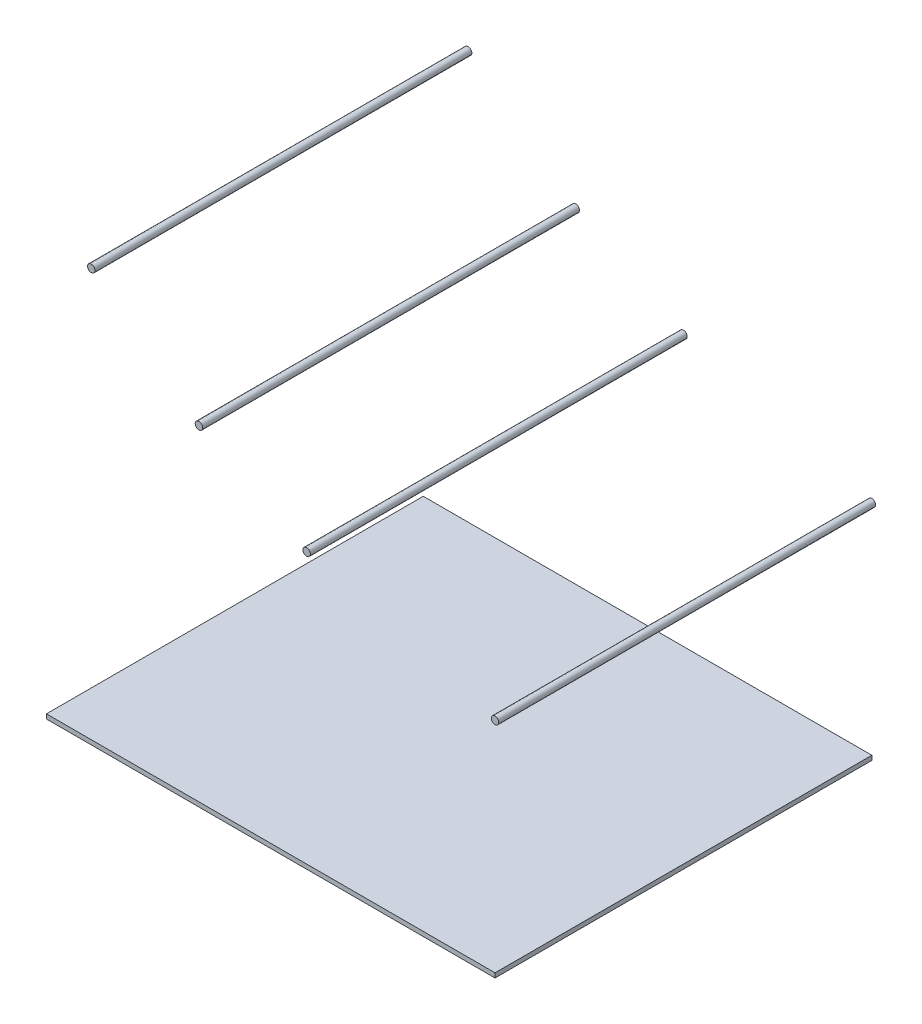
from build123d import *

# Parameters (mm, degrees)
SKETCH1_R             = 21.082
BOSS_EXTRUDE1_DEPTH   = 1066.8
BOSS_EXTRUDE1_2_DEPTH = 1066.8
BOSS_EXTRUDE1_3_DEPTH = 1066.8
BOSS_EXTRUDE1_4_DEPTH = 1066.8
SKETCH1_W             = 2540
SKETCH1_H             = 25.4
BOSS_EXTRUDE1_5_DEPTH = 1066.8


with BuildPart() as part:
    # Sketch1 → Boss-Extrude1 (new, symmetric)
    with BuildSketch(Plane.XY):
        with Locations((0, 1238.25)):
            Circle(SKETCH1_R)
    extrude(amount=BOSS_EXTRUDE1_DEPTH, both=True)


with BuildPart() as body_2:
    # Sketch1 → Boss-Extrude1 2 (new, symmetric)
    with BuildSketch(Plane.XY):
        with Locations((-1066.8, 1530.35)):
            Circle(SKETCH1_R)
    extrude(amount=BOSS_EXTRUDE1_2_DEPTH, both=True)


with BuildPart() as body_3:
    # Sketch1 → Boss-Extrude1 3 (new, symmetric)
    with BuildSketch(Plane.XY):
        with Locations((-1676.4, 1844.675)):
            Circle(SKETCH1_R)
    extrude(amount=BOSS_EXTRUDE1_3_DEPTH, both=True)


with BuildPart() as body_4:
    # Sketch1 → Boss-Extrude1 4 (new, symmetric)
    with BuildSketch(Plane.XY):
        with Locations((-2286, 2311.4)):
            Circle(SKETCH1_R)
    extrude(amount=BOSS_EXTRUDE1_4_DEPTH, both=True)


with BuildPart() as body_5:
    # Sketch1 → Boss-Extrude1 5 (new, symmetric)
    with BuildSketch(Plane.XY):
        with Locations((-1270, -12.7)):
            Rectangle(SKETCH1_W, SKETCH1_H)
    extrude(amount=BOSS_EXTRUDE1_5_DEPTH, both=True)


solid = Compound([part.part, body_2.part, body_3.part, body_4.part, body_5.part])
